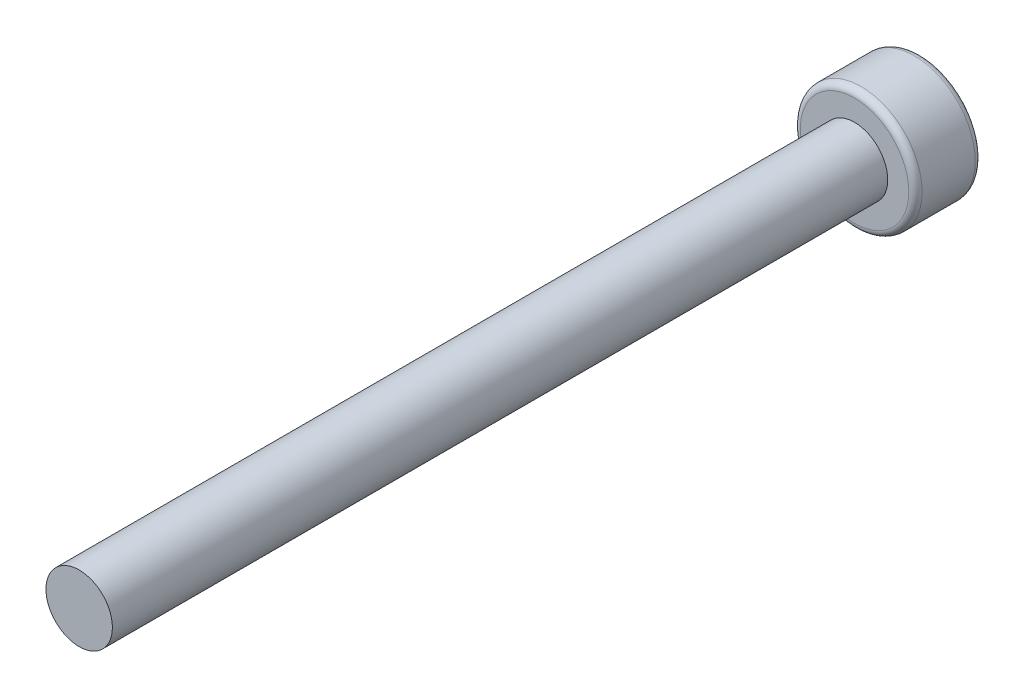
from build123d import *

# Parameters (mm, degrees)
SKETCH_1_R          = 2.75
EXTRUDE_1_DEPTH     = 3
SKETCH_2_R          = 1.5
EXTRUDE_2_DEPTH     = 35
FILLET_1_R          = 0.3
CUT_EXTRUDE_1_DEPTH = 2


with BuildPart() as part:
    # 草图1 → 凸台-拉伸1 (new body)
    with BuildSketch(Plane.XY):
        Circle(SKETCH_1_R)
    extrude(amount=EXTRUDE_1_DEPTH)

    # 草图2 → 凸台-拉伸2 (add)
    with BuildSketch(Plane.XY.offset(3)):
        Circle(SKETCH_2_R)
    extrude(amount=EXTRUDE_2_DEPTH)

    # 圆角1
    fillet_1_edges = [part.edges().sort_by_distance(p)[0] for p in [
        (-2.75, 0, 0),
        (-2.75, 0, 3),
    ]]
    fillet(fillet_1_edges, radius=FILLET_1_R)

    # 草图3 → 切除-拉伸1 (cut)
    with BuildSketch(Plane(origin=(0, 0, 0), x_dir=(-1, 0, 0), z_dir=(0, 0, -1))):
        Polygon((-0.820853493, 1.862408161), (-2.023319526, 0.220324103), (-1.202466033, -1.642084058), (0.820853493, -1.862408161), (2.023319526, -0.220324103), (1.202466033, 1.642084058), align=None)
    extrude(amount=-CUT_EXTRUDE_1_DEPTH, mode=Mode.SUBTRACT)


solid = part.part
